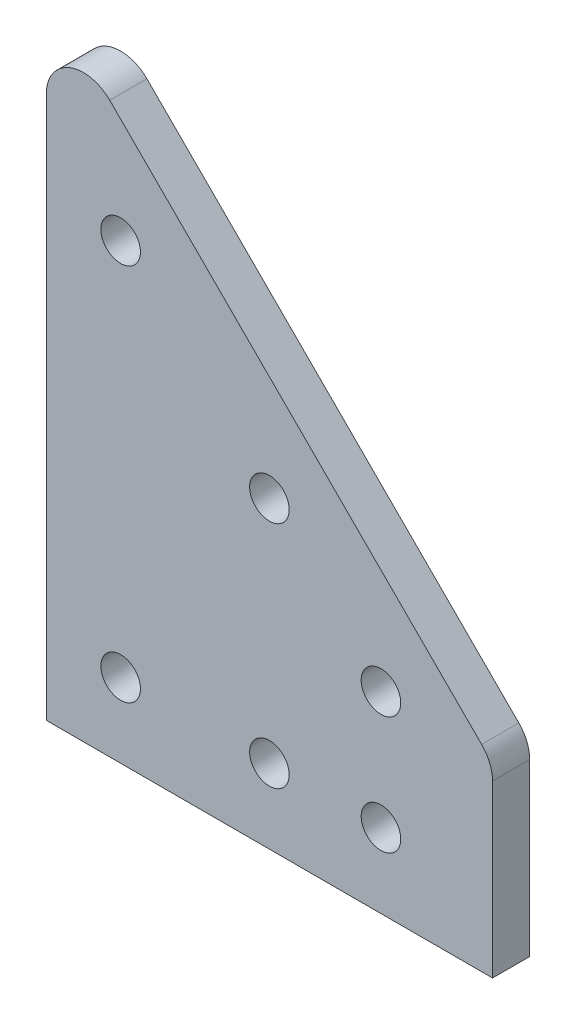
from build123d import *

# Parameters (mm, degrees)
BOSS_EXTRUDE1_DEPTH     = 3.175
F_1_4_CLEARANCE_HOLE1_D = 6.7564
FILLET1_R               = 6.35


with BuildPart() as part:
    # Sketch1 → Boss-Extrude1 (new, symmetric)
    with BuildSketch(Plane.XY):
        Polygon((-38.1, -15.875), (38.1, -15.875), (38.1, 15.875), (-38.1, 92.075), align=None)
    extrude(amount=BOSS_EXTRUDE1_DEPTH, both=True)

    # 1/4 Clearance Hole1 (through all)
    with Locations(Plane.XY.offset(3.175)):
        with Locations((-25.4, 61.414487758), (0, 36.014487758), (19.05, 16.964487758), (-25.4, -3.175), (19.05, -3.175), (0, -3.175)):
            Hole(F_1_4_CLEARANCE_HOLE1_D / 2)

    # Fillet1
    fillet1_edges = [part.edges().sort_by_distance(p)[0] for p in [
        (-38.1, 92.075, 0),
        (38.1, 15.875, 0),
    ]]
    fillet(fillet1_edges, radius=FILLET1_R)


solid = part.part
